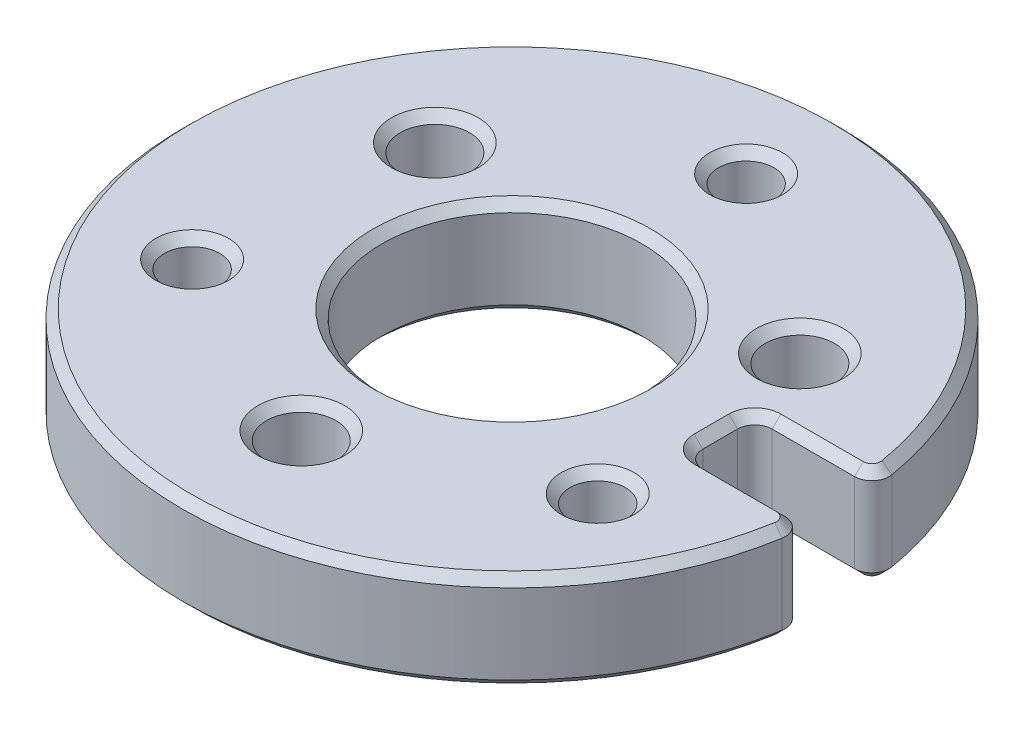
from build123d import *

# Parameters (mm, degrees)
SKETCH_1_R          = 19
SKETCH_1_R_2        = 2
SKETCH_1_R_3        = 7.5
SKETCH_1_R_4        = 1.6
EXTRUDE_1_DEPTH     = 5.6
SKETCH_2_W          = 15.17824661
SKETCH_2_H          = 4
CUT_EXTRUDE_1_DEPTH = 10
FILLET_1_R          = 1
CHAMFER_1_SIZE      = 0.5
CHAMFER_2_SIZE      = 0.5


with BuildPart() as part:
    # 草图1 → 凸台-拉伸1 (new body)
    with BuildSketch(Plane(origin=(0, 0, 0), x_dir=(1, 0, 0), z_dir=(0, 1, 0))):
        with Locations(Location((0, 0, 0), (0, 0, 270))):
            Circle(SKETCH_1_R)
        with Locations(Location((0, -12.15, 0), (0, 0, 270))):
            Circle(SKETCH_1_R_2, mode=Mode.SUBTRACT)
        with Locations(Location((10.522208656, 6.075, 0), (0, 0, 270))):
            Circle(SKETCH_1_R_2, mode=Mode.SUBTRACT)
        with Locations(Location((-10.522208656, 6.075, 0), (0, 0, 270))):
            Circle(SKETCH_1_R_2, mode=Mode.SUBTRACT)
        with Locations(Location((0, 0, 0), (0, 0, 270))):
            Circle(SKETCH_1_R_3, mode=Mode.SUBTRACT)
        with Locations(Location((-11.691342951, -6.75, 0), (0, 0, 270))):
            Circle(SKETCH_1_R_4, mode=Mode.SUBTRACT)
        with Locations(Location((11.691342951, -6.75, 0), (0, 0, 270))):
            Circle(SKETCH_1_R_4, mode=Mode.SUBTRACT)
        with Locations(Location((0, 13.5, 0), (0, 0, 270))):
            Circle(SKETCH_1_R_4, mode=Mode.SUBTRACT)
    extrude(amount=EXTRUDE_1_DEPTH)

    # 草图2 → 切除-拉伸1 (cut)
    with BuildSketch(Plane(origin=(0, 5.6, 0), x_dir=(1, 0, 0), z_dir=(0, 1, 0))):
        with Locations((19.589123305, 0)):
            Rectangle(SKETCH_2_W, SKETCH_2_H)
    extrude(amount=-CUT_EXTRUDE_1_DEPTH, mode=Mode.SUBTRACT)

    # 圆角1
    fillet_1_edges = [part.edges().sort_by_distance(p)[0] for p in [
        (12, 2.8, 2),
        (18.894443628, 2.8, -2),
        (12, 2.8, -2),
        (18.894443628, 2.8, 2),
    ]]
    fillet(fillet_1_edges, radius=FILLET_1_R)

    # 倒角1
    chamfer_1_edges = [part.edges().sort_by_distance(p)[0] for p in [
        (-19, 5.6, 0),
        (-19, 0, 0),
        (15.374119675, 5.6, -2),
        (15.374119675, 5.6, 2),
        (12, 5.6, 0),
        (18.512001965, 5.6, -2.354502776),
        (18.512001965, 5.6, 2.354502776),
        (15.374119675, 0, 2),
        (15.374119675, 0, -2),
        (12, 0, 0),
        (18.512001965, 0, -2.354502776),
        (18.512001965, 0, 2.354502776),
        (12.292893219, 5.6, 1.707106781),
        (12.292893219, 0, 1.707106781),
        (12.292893219, 5.6, -1.707106781),
        (12.292893219, 0, -1.707106781),
    ]]
    chamfer(chamfer_1_edges, length=CHAMFER_1_SIZE)

    # 倒角2
    chamfer_2_edges = [part.edges().sort_by_distance(p)[0] for p in [
        (0, 5.6, 10.15),
        (0, 0, -15.1),
        (11.691342951, 0, 5.15),
        (-11.691342951, 0, 5.15),
        (0, 0, -7.5),
        (-10.522208656, 0, -8.075),
        (10.522208656, 0, -8.075),
        (0, 0, 10.15),
        (10.522208656, 5.6, -8.075),
        (-10.522208656, 5.6, -8.075),
        (0, 5.6, -7.5),
        (-11.691342951, 5.6, 5.15),
        (11.691342951, 5.6, 5.15),
        (0, 5.6, -15.1),
    ]]
    chamfer(chamfer_2_edges, length=CHAMFER_2_SIZE)


solid = part.part
